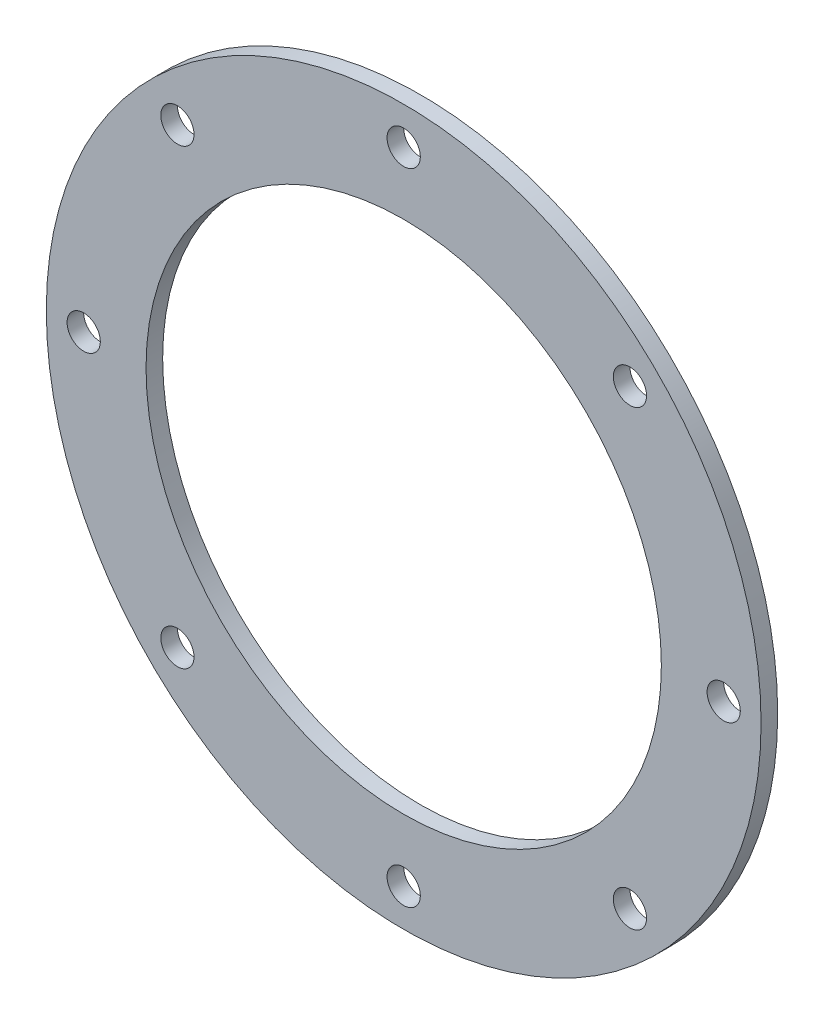
from build123d import *

# Parameters (mm, degrees)
SKETCH1_R           = 2
SKETCH1_R_2         = 31
BOSS_EXTRUDE1_DEPTH = 1


with BuildPart() as part:
    # Sketch1 → Boss-Extrude1 (new, symmetric)
    with BuildSketch(Plane.XY):
        with BuildLine():
            ThreePointArc((41.821047333, 10), (0, 43), (-41.821047333, 10))
            ThreePointArc((-41.821047333, 10), (-43, 0), (-41.821047333, -10))
            ThreePointArc((-41.821047333, -10), (-41.753494763, -10.278408199), (-41.684088814, -10.556360154))
            ThreePointArc((-41.684088814, -10.556360154), (0.263191219, -42.999194532), (41.810188324, -10.045304987))
            ThreePointArc((41.810188324, -10.045304987), (41.815623964, -10.022653964), (41.821047333, -10))
            ThreePointArc((41.821047333, -10), (43, 0), (41.821047333, 10))
        make_face()
        with Locations((-27.223611076, -27.223611076)):
            Circle(SKETCH1_R, mode=Mode.SUBTRACT)
        with Locations((0, -38.5)):
            Circle(SKETCH1_R, mode=Mode.SUBTRACT)
        with Locations((27.223611076, -27.223611076)):
            Circle(SKETCH1_R, mode=Mode.SUBTRACT)
        with Locations((-38.5, 0)):
            Circle(SKETCH1_R, mode=Mode.SUBTRACT)
        with Locations((-27.223611076, 27.223611076)):
            Circle(SKETCH1_R, mode=Mode.SUBTRACT)
        Circle(SKETCH1_R_2, mode=Mode.SUBTRACT)
        with Locations((38.5, 0)):
            Circle(SKETCH1_R, mode=Mode.SUBTRACT)
        with Locations((27.223611076, 27.223611076)):
            Circle(SKETCH1_R, mode=Mode.SUBTRACT)
        with Locations((0, 38.5)):
            Circle(SKETCH1_R, mode=Mode.SUBTRACT)
    extrude(amount=BOSS_EXTRUDE1_DEPTH, both=True)


solid = part.part
